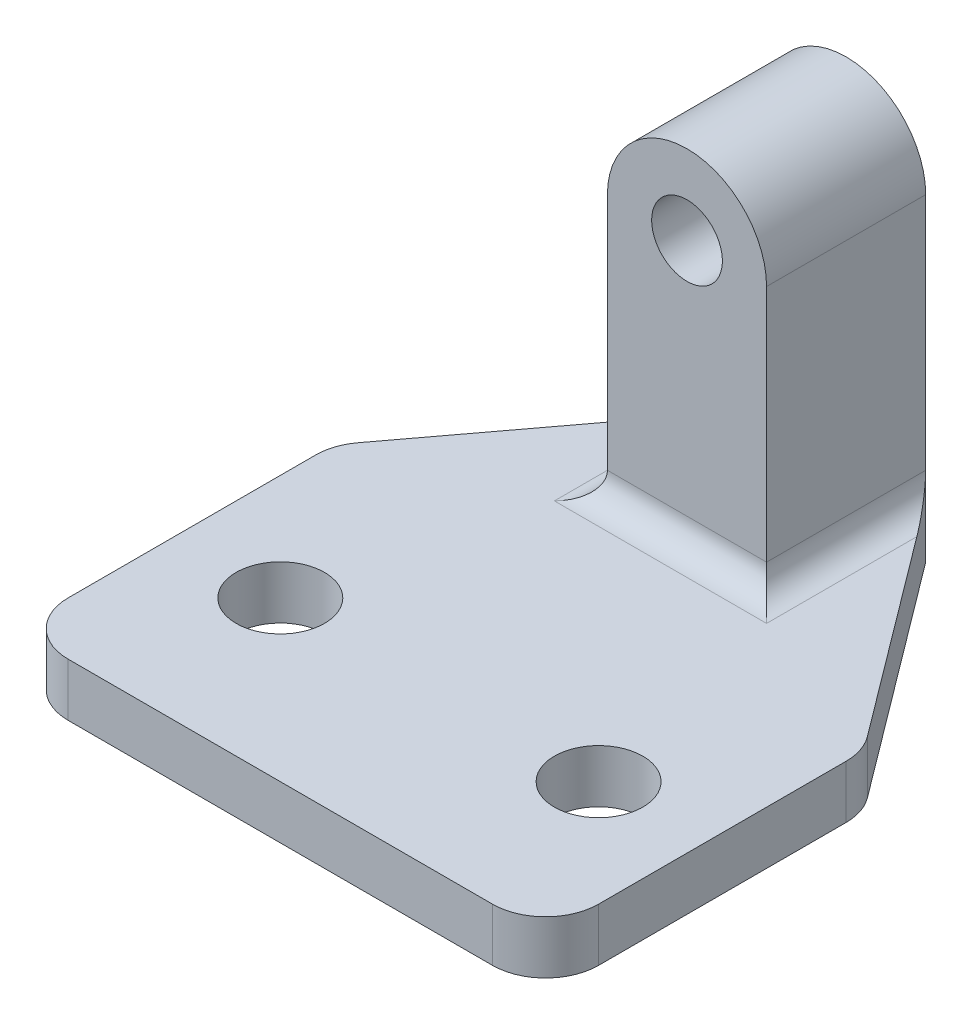
from build123d import *

# Parameters (mm, degrees)
BOSS_EXTRUDE1_DEPTH = 3
SKETCH2_R           = 2
BOSS_EXTRUDE2_DEPTH = 9
FILLET1_R           = 1.5
FILLET2_R           = 3
SKETCH3_R           = 2.5
CUT_EXTRUDE1_DEPTH  = 34.678628238


with BuildPart() as part:
    # Sketch1 → Boss-Extrude1 (new body)
    with BuildSketch(Plane(origin=(0, 0, 0), x_dir=(1, 0, 0), z_dir=(0, 1, 0))):
        Polygon((-15, 9), (-4.5, 23), (4.5, 23), (15, 9), (15, -9), (-15, -9), align=None)
    extrude(amount=BOSS_EXTRUDE1_DEPTH)

    # Sketch2 → Boss-Extrude2 (add)
    with BuildSketch(Plane(origin=(0, 0, -23), x_dir=(-1, 0, 0), z_dir=(0, 0, -1))):
        with BuildLine():
            Line((-4.5, 3), (-4.5, 18))
            ThreePointArc((-4.5, 18), (0, 22.5), (4.5, 18))
            Line((4.5, 18), (4.5, 3))
            Line((4.5, 3), (-4.5, 3))
        make_face()
        with Locations((0, 18)):
            Circle(SKETCH2_R, mode=Mode.SUBTRACT)
    extrude(amount=-BOSS_EXTRUDE2_DEPTH)

    # Fillet1
    fillet1_edges = [part.edges().sort_by_distance(p)[0] for p in [
        (0, 3, -14),
        (-4.5, 3, -18.5),
        (4.5, 3, -18.5),
    ]]
    fillet(fillet1_edges, radius=FILLET1_R)

    # Fillet2
    fillet2_edges = [part.edges().sort_by_distance(p)[0] for p in [
        (-15, 1.5, -9),
        (15, 1.5, -9),
        (15, 1.5, 9),
        (-15, 1.5, 9),
    ]]
    fillet(fillet2_edges, radius=FILLET2_R)

    # Sketch3 → Cut-Extrude1 (cut, through all)
    with BuildSketch(Plane(origin=(0, 3, 0), x_dir=(1, 0, 0), z_dir=(0, 1, 0))):
        with Locations(Location((-9, 0, 0), (0, 0, 270))):
            Circle(SKETCH3_R)
        with Locations(Location((9, 0, 0), (0, 0, 90))):
            Circle(SKETCH3_R)
    extrude(amount=-CUT_EXTRUDE1_DEPTH, mode=Mode.SUBTRACT)


solid = part.part
